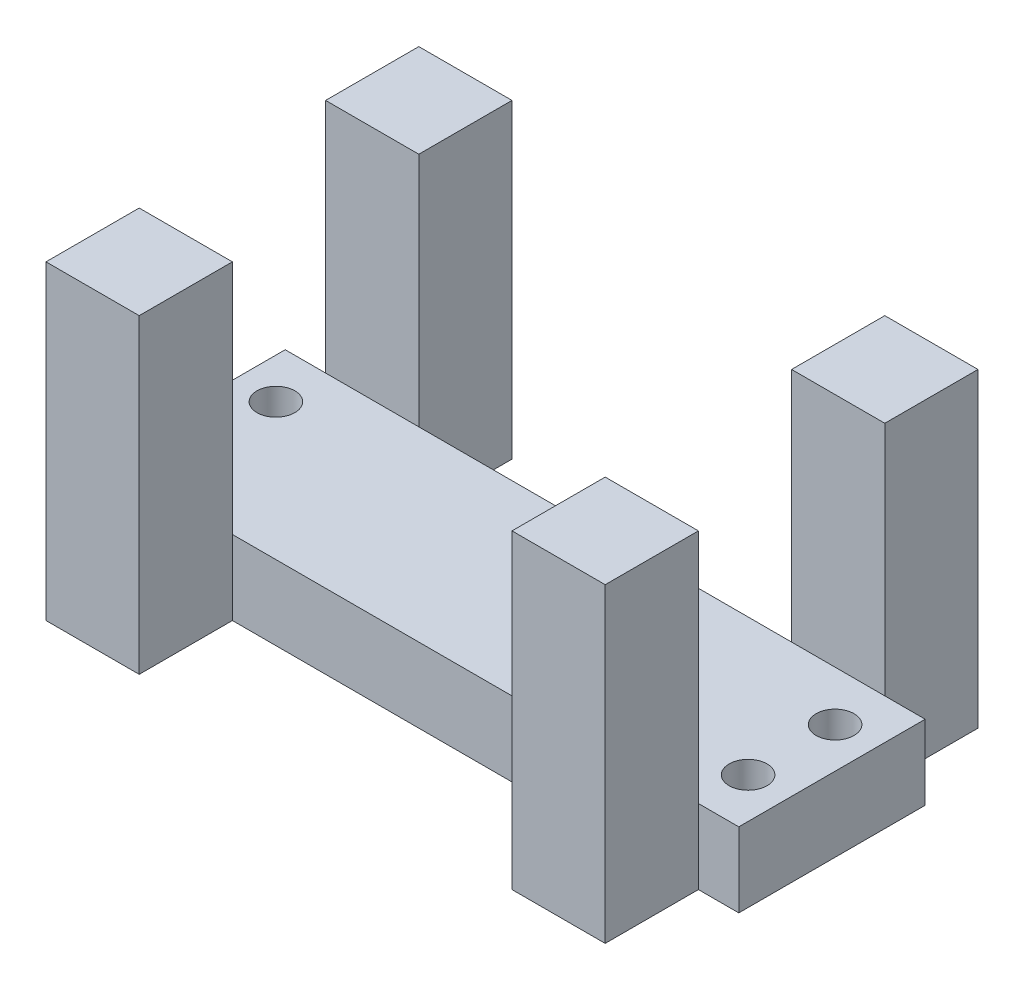
from build123d import *

# Parameters (mm, degrees)
SKETCH1_W           = 103
SKETCH1_H           = 30
BOSS_EXTRUDE1_DEPTH = 12
SKETCH2_R           = 3.05
CUT_EXTRUDE1_DEPTH  = 12
SKETCH4_W           = 15
SKETCH4_H           = 15
BOSS_EXTRUDE3_DEPTH = 50


with BuildPart() as part:
    # Sketch1 → Boss-Extrude1 (new body)
    with BuildSketch(Plane(origin=(0, 0, 0), x_dir=(1, 0, 0), z_dir=(0, 1, 0))):
        with Locations((51.5, 15)):
            Rectangle(SKETCH1_W, SKETCH1_H)
    extrude(amount=BOSS_EXTRUDE1_DEPTH)

    # Sketch2 → Cut-Extrude1 (cut)
    with BuildSketch(Plane(origin=(0, 12, 0), x_dir=(1, 0, 0), z_dir=(0, 1, 0))):
        with Locations(Location((6.5, 8, 0), (0, 0, 270))):
            Circle(SKETCH2_R)
        with Locations(Location((6.5, 22, 0), (0, 0, 90))):
            Circle(SKETCH2_R)
        with Locations(Location((96.5, 8, 0), (0, 0, 90))):
            Circle(SKETCH2_R)
        with Locations(Location((96.5, 22, 0), (0, 0, 270))):
            Circle(SKETCH2_R)
    extrude(amount=-CUT_EXTRUDE1_DEPTH, mode=Mode.SUBTRACT)

    # Sketch4 → Boss-Extrude3 (add)
    with BuildSketch(Plane.XZ):
        with Locations((89, 7.5)):
            Rectangle(SKETCH4_W, SKETCH4_H)
        with Locations((89, -37.5)):
            Rectangle(SKETCH4_W, SKETCH4_H)
        with Locations((14, -37.5)):
            Rectangle(SKETCH4_W, SKETCH4_H)
        with Locations((14, 7.5)):
            Rectangle(SKETCH4_W, SKETCH4_H)
    extrude(amount=-BOSS_EXTRUDE3_DEPTH)


solid = part.part
